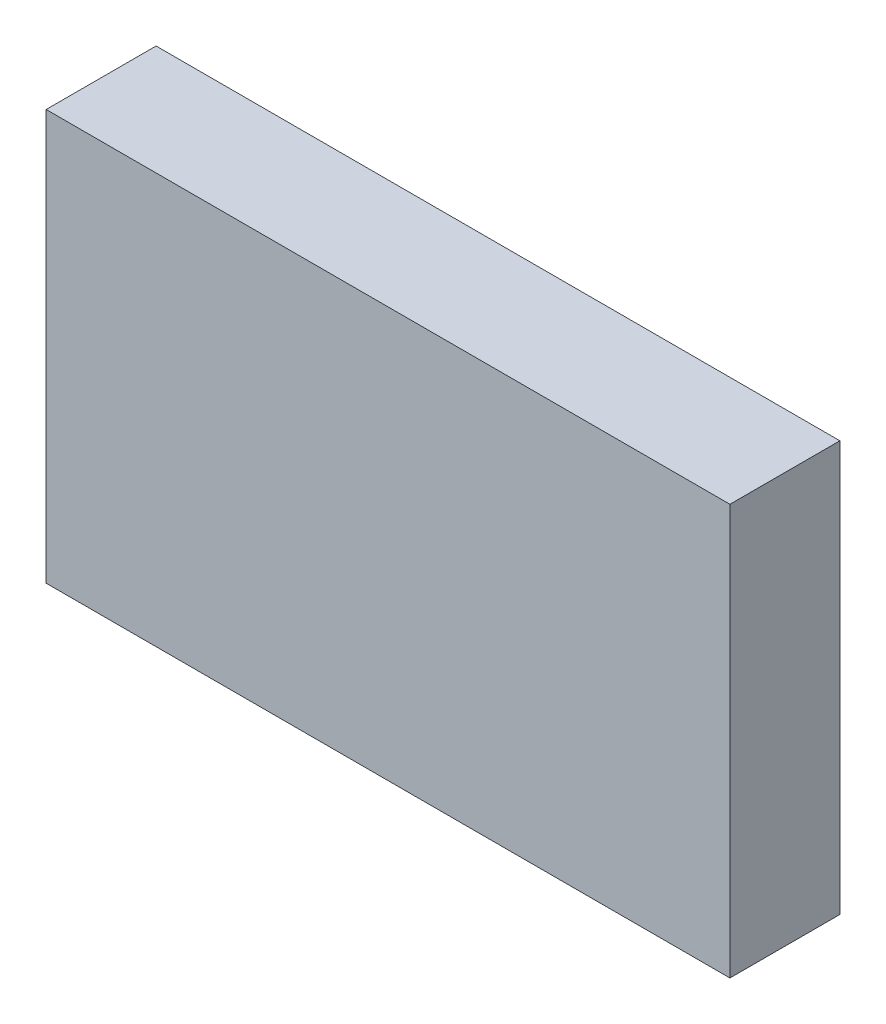
from build123d import *

# Parameters (mm, degrees)
SKETCH1_W           = 25
SKETCH1_H           = 15
BOSS_EXTRUDE1_DEPTH = 4.02


with BuildPart() as part:
    # Sketch1 → Boss-Extrude1 (new body)
    with BuildSketch(Plane.XY):
        Rectangle(SKETCH1_W, SKETCH1_H)
    extrude(amount=BOSS_EXTRUDE1_DEPTH)


solid = part.part
